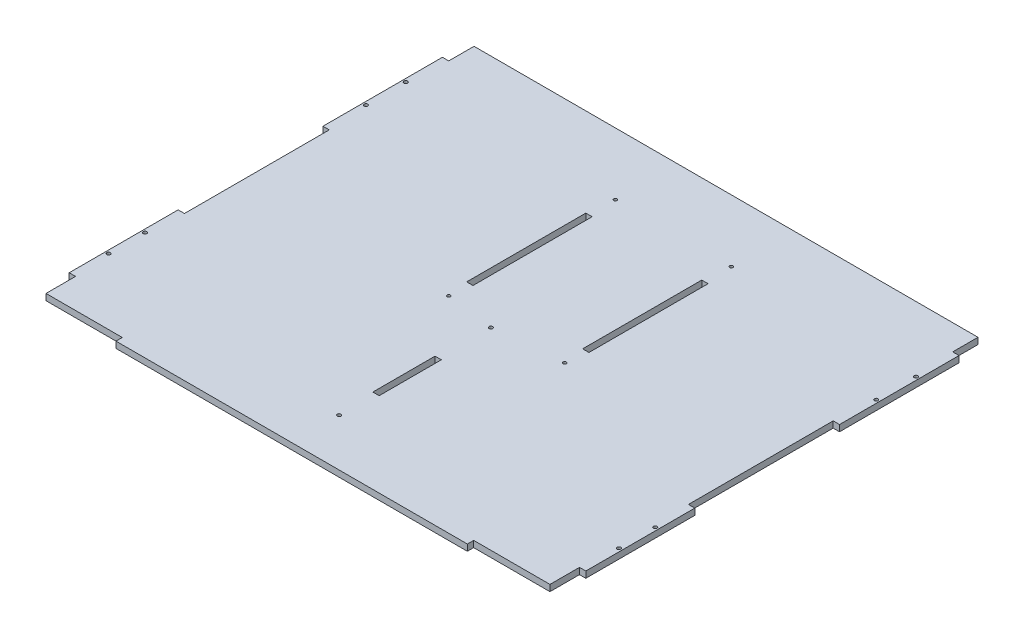
from build123d import *

# Parameters (mm, degrees)
SKETCH1_W             = 490
SKETCH1_H             = 411.98
BOSS_EXTRUDE1_DEPTH   = 6
SKETCH2_W             = 78.33333333
SKETCH2_H             = 6
SKETCH2_W_2           = 6
SKETCH2_H_2           = 137.326666666
CUT_EXTRUDE1_DEPTH    = 12
SKETCH4_W             = 6
SKETCH4_H             = 24
SKETCH4_H_2           = 27.996666667
CUT_EXTRUDE2_DEPTH    = 12
SKETCH6_W             = 6
SKETCH6_H             = 58.97
CUT_EXTRUDE3_DEPTH    = 641.20584221
M3_CLEARANCE_HOLE1_D  = 3.4
F_3_0MM_DOWEL_HOLE1_D = 3
CUT_EXTRUDE4_REACH    = 642.206
SKETCH11_W            = 6
SKETCH11_H            = 113


with BuildPart() as part:
    # Sketch1 → Boss-Extrude1 (new body)
    with BuildSketch(Plane(origin=(0, 0, 0), x_dir=(1, 0, 0), z_dir=(0, 1, 0))):
        with Locations((245, 205.99)):
            Rectangle(SKETCH1_W, SKETCH1_H)
    extrude(amount=BOSS_EXTRUDE1_DEPTH)

    # Sketch2 → Cut-Extrude1 (cut)
    with BuildSketch(Plane(origin=(0, 6, 0), x_dir=(1, 0, 0), z_dir=(0, 1, 0))):
        with Locations((39.166666665, 3)):
            Rectangle(SKETCH2_W, SKETCH2_H)
        with Locations((450.833333335, 3)):
            Rectangle(SKETCH2_W, SKETCH2_H)
        with Locations((3, 205.99)):
            Rectangle(SKETCH2_W_2, SKETCH2_H_2)
        with Locations((487, 205.99)):
            Rectangle(SKETCH2_W_2, SKETCH2_H_2)
    extrude(amount=-CUT_EXTRUDE1_DEPTH, mode=Mode.SUBTRACT)

    # Sketch4 → Cut-Extrude2 (cut)
    with BuildSketch(Plane(origin=(0, 6, 0), x_dir=(1, 0, 0), z_dir=(0, 1, 0))):
        with Locations((3, 399.98)):
            Rectangle(SKETCH4_W, SKETCH4_H)
        with Locations((487, 399.98)):
            Rectangle(SKETCH4_W, SKETCH4_H)
        with Locations((487, 19.998333333)):
            Rectangle(SKETCH4_W, SKETCH4_H_2)
        with Locations((3, 19.998333333)):
            Rectangle(SKETCH4_W, SKETCH4_H_2)
    extrude(amount=-CUT_EXTRUDE2_DEPTH, mode=Mode.SUBTRACT)

    # Sketch6 → Cut-Extrude3 (cut, through all)
    with BuildSketch(Plane(origin=(0, 6, 0), x_dir=(1, 0, 0), z_dir=(0, 1, 0))):
        with Locations((245, 109.485)):
            Rectangle(SKETCH6_W, SKETCH6_H)
    extrude(amount=-CUT_EXTRUDE3_DEPTH, mode=Mode.SUBTRACT)

    # M3 Clearance Hole1 (through all)
    with Locations(Plane(origin=(0, 6, 0), x_dir=(1, 0, 0), z_dir=(0, 1, 0))):
        with Locations((3, 350.203333333), (3, 312.43), (3, 102.883333333), (3, 68.44), (487, 350.203333333), (487, 312.43), (487, 102.883333333), (487, 68.44), (245, 188.97), (245, 45)):
            Hole(M3_CLEARANCE_HOLE1_D / 2)

    # Ø3.0mm Dowel Hole1 (through all)
    with Locations(Plane(origin=(0, 6, 0), x_dir=(1, 0, 0), z_dir=(0, 1, 0))):
        with Locations((309, 352.98), (309, 194.98), (199, 352.98), (199, 194.98)):
            Hole(F_3_0MM_DOWEL_HOLE1_D / 2)

    # Sketch11 → Cut-Extrude4 (cut, up to next)
    with BuildSketch(Plane.XZ, mode=Mode.PRIVATE) as cut_extrude4_sk1:
        with Locations((309, -271.48)):
            Rectangle(SKETCH11_W, SKETCH11_H)
    cut_extrude4_tool1 = extrude(cut_extrude4_sk1.sketch, amount=-CUT_EXTRUDE4_REACH, mode=Mode.PRIVATE) & part.part
    # Sketch11 → Cut-Extrude4 (cut, up to next)
    with BuildSketch(Plane.XZ, mode=Mode.PRIVATE) as cut_extrude4_sk2:
        with Locations((199, -271.48)):
            Rectangle(SKETCH11_W, SKETCH11_H)
    cut_extrude4_tool2 = extrude(cut_extrude4_sk2.sketch, amount=-CUT_EXTRUDE4_REACH, mode=Mode.PRIVATE) & part.part
    add(cut_extrude4_tool1.solids().sort_by_distance((309, 0, -271.48))[0], mode=Mode.SUBTRACT)
    add(cut_extrude4_tool2.solids().sort_by_distance((199, 0, -271.48))[0], mode=Mode.SUBTRACT)


solid = part.part
